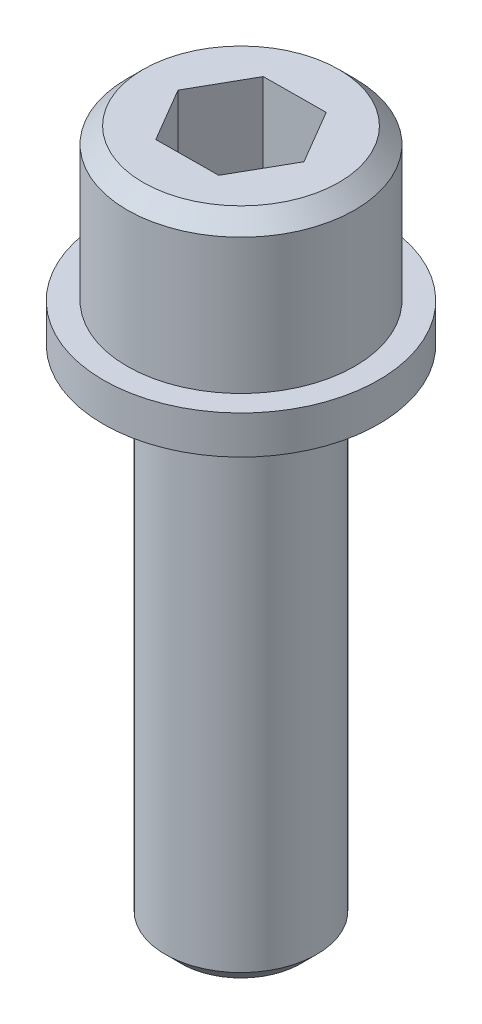
from build123d import *

# Parameters (mm, degrees)
SKETCH1_R           = 8.65
BOSS_EXTRUDE1_DEPTH = 2.4
SKETCH2_R           = 7.15
BOSS_EXTRUDE2_DEPTH = 9.5
CHAMFER2_SIZE       = 1
CUT_EXTRUDE1_DEPTH  = 6.4
SKETCH4_R           = 4.75
BOSS_EXTRUDE3_DEPTH = 31.8
CHAMFER3_SIZE       = 1


with BuildPart() as part:
    # Sketch1 → Boss-Extrude1 (new body)
    with BuildSketch(Plane(origin=(0, 0, 0), x_dir=(1, 0, 0), z_dir=(0, 1, 0))):
        with Locations(Location((0, 0, 0), (0, 0, 270))):
            Circle(SKETCH1_R)
    extrude(amount=BOSS_EXTRUDE1_DEPTH)

    # Sketch2 → Boss-Extrude2 (add)
    with BuildSketch(Plane(origin=(0, 2.4, 0), x_dir=(1, 0, 0), z_dir=(0, 1, 0))):
        with Locations(Location((0, 0, 0), (0, 0, 270))):
            Circle(SKETCH2_R)
    extrude(amount=BOSS_EXTRUDE2_DEPTH)

    # Chamfer2
    chamfer2_edges = [part.edges().sort_by_distance(p)[0] for p in [
        (0, 11.9, -7.15),
    ]]
    chamfer(chamfer2_edges, length=CHAMFER2_SIZE)

    # Sketch3 → Cut-Extrude1 (cut)
    with BuildSketch(Plane(origin=(0, 11.9, 0), x_dir=(1, 0, 0), z_dir=(0, 1, 0))):
        Polygon((-1.987918608, 3.385485629), (-3.925875862, -0.0288452), (-1.937957255, -3.414330829), (1.987918608, -3.385485629), (3.925875862, 0.0288452), (1.937957255, 3.414330829), align=None)
    extrude(amount=-CUT_EXTRUDE1_DEPTH, mode=Mode.SUBTRACT)

    # Sketch4 → Boss-Extrude3 (add)
    with BuildSketch(Plane.XZ):
        with Locations(Location((0, 0, 0), (0, 0, 270))):
            Circle(SKETCH4_R)
    extrude(amount=BOSS_EXTRUDE3_DEPTH)

    # Chamfer3
    chamfer3_edges = [part.edges().sort_by_distance(p)[0] for p in [
        (0, -31.8, 4.75),
    ]]
    chamfer(chamfer3_edges, length=CHAMFER3_SIZE)


solid = part.part
